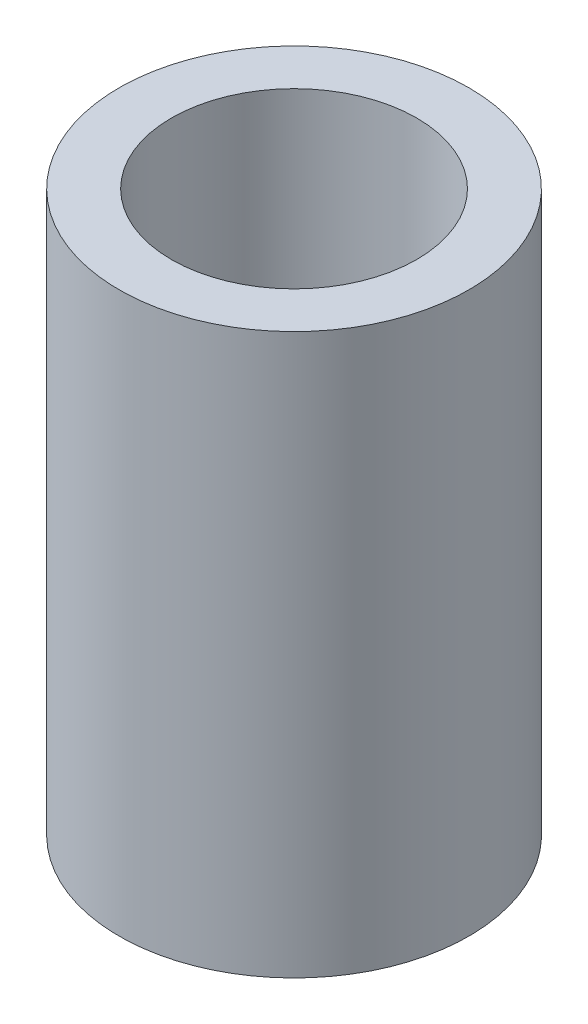
from build123d import *

# Parameters (mm, degrees)
SKETCH1_W = 0.747395
SKETCH1_H = 8.000000002


with BuildPart() as part:
    # Sketch1 → Revolve1 (revolve)
    with BuildSketch(Plane.XY, mode=Mode.PRIVATE) as revolve1_sk:
        with Locations((2.1262975, 4.000000001)):
            Rectangle(SKETCH1_W, SKETCH1_H)
    revolve(revolve1_sk.sketch.rotate(Axis((0, 8.000000002, 0), (0, -1, 0)), 270), axis=Axis((0, 8.000000002, 0), (0, -1, 0)))


solid = part.part
